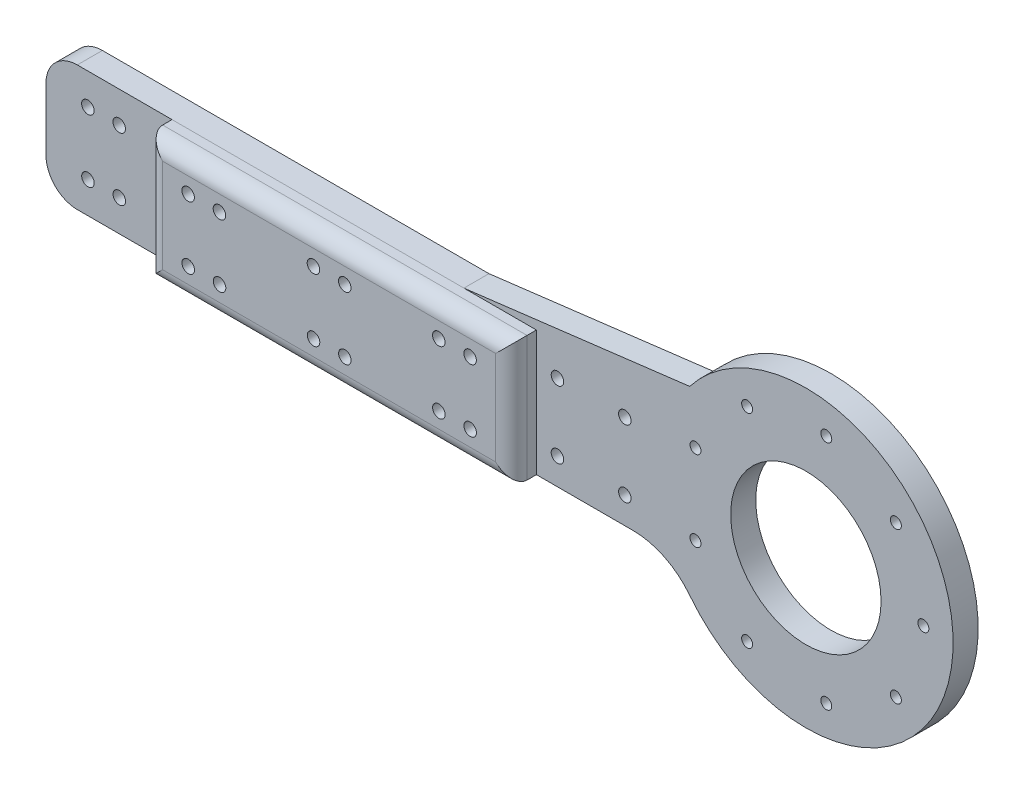
from build123d import *

# Parameters (mm, degrees)
SKETCH_1_R          = 24
SKETCH_1_R_2        = 1.75
EXTRUDE_1_DEPTH     = 8
FILLET_1_R          = 10
FILLET_3_R          = 10
FILLET_8_R          = 23
FILLET_9_R          = 23
SKETCH_3_R          = 2
CUT_EXTRUDE_1_DEPTH = 196.43671136
RIB_1_REACH         = 197.437
SKETCH_6_WALL_W     = 465.474103638
SKETCH_6_WALL_H     = 8
EXTRUDE_START       = 8
SKETCH_11_W         = 116.312569084
SKETCH_11_H         = 40.000018321
SKETCH_11_R         = 2
EXTRUDE_2_DEPTH     = 8
FILLET_11_R         = 5


with BuildPart() as part:
    # 草图1 → 凸台-拉伸1 (new body)
    with BuildSketch(Plane.XY):
        with BuildLine():
            Line((-100, -20), (100, -20))
            ThreePointArc((100, -20), (189.532340636, 0), (100, 20))
            Line((100, 20), (-100, 20))
            Line((-100, 20), (-100, -20))
        make_face()
        with Locations((142.532340636, 0)):
            Circle(SKETCH_1_R, mode=Mode.SUBTRACT)
        with Locations((123.782340636, 32.475952642)):
            Circle(SKETCH_1_R_2, mode=Mode.SUBTRACT)
        with Locations((107.293867357, 12.825755375)):
            Circle(SKETCH_1_R_2, mode=Mode.SUBTRACT)
        with Locations((107.293867357, -12.825755375)):
            Circle(SKETCH_1_R_2, mode=Mode.SUBTRACT)
        with Locations((123.782340636, -32.475952642)):
            Circle(SKETCH_1_R_2, mode=Mode.SUBTRACT)
        with Locations((149.044147299, -36.930290738)):
            Circle(SKETCH_1_R_2, mode=Mode.SUBTRACT)
        with Locations((171.259007253, -24.104535363)):
            Circle(SKETCH_1_R_2, mode=Mode.SUBTRACT)
        with Locations((180.032340636, 0)):
            Circle(SKETCH_1_R_2, mode=Mode.SUBTRACT)
        with Locations((171.259007253, 24.104535363)):
            Circle(SKETCH_1_R_2, mode=Mode.SUBTRACT)
        with Locations((149.044147299, 36.930290738)):
            Circle(SKETCH_1_R_2, mode=Mode.SUBTRACT)
    extrude(amount=EXTRUDE_1_DEPTH)

    # 圆角1
    fillet_1_edges = [part.edges().sort_by_distance(p)[0] for p in [
        (-100, 20, 4),
    ]]
    fillet(fillet_1_edges, radius=FILLET_1_R)

    # 圆角3
    fillet_3_edges = [part.edges().sort_by_distance(p)[0] for p in [
        (-100, -20, 4),
    ]]
    fillet(fillet_3_edges, radius=FILLET_3_R)

    # 圆角8
    fillet_8_edges = [part.edges().sort_by_distance(p)[0] for p in [
        (100, -20, 4),
    ]]
    fillet(fillet_8_edges, radius=FILLET_8_R)

    # 圆角9
    fillet_9_edges = [part.edges().sort_by_distance(p)[0] for p in [
        (100, 20, 4),
    ]]
    fillet(fillet_9_edges, radius=FILLET_9_R)

    # 草图3 → 切除-拉伸1 (cut, through all)
    with BuildSketch(Plane.XY.offset(8)):
        with Locations((-86.637479545, 10)):
            Circle(SKETCH_3_R)
        with Locations((-86.610408267, -9.999981679)):
            Circle(SKETCH_3_R)
        with Locations((-76.637479545, 10)):
            Circle(SKETCH_3_R)
        with Locations((-76.610408267, -9.999981679)):
            Circle(SKETCH_3_R)
        with Locations((-46.637479545, 10)):
            Circle(SKETCH_3_R)
        with Locations((-46.610408267, -9.999981679)):
            Circle(SKETCH_3_R)
        with Locations((-36.637479545, 10)):
            Circle(SKETCH_3_R)
        with Locations((-36.610408267, -9.999981679)):
            Circle(SKETCH_3_R)
        with Locations((-6.637479545, 10)):
            Circle(SKETCH_3_R)
        with Locations((-6.610408267, -9.999981679)):
            Circle(SKETCH_3_R)
        with Locations((3.362520455, 10)):
            Circle(SKETCH_3_R)
        with Locations((3.389591733, -9.999981679)):
            Circle(SKETCH_3_R)
        with Locations((33.362520455, 10)):
            Circle(SKETCH_3_R)
        with Locations((33.389591733, -9.999981679)):
            Circle(SKETCH_3_R)
        with Locations((43.362520455, 10)):
            Circle(SKETCH_3_R)
        with Locations((43.389591733, -9.999981679)):
            Circle(SKETCH_3_R)
        with Locations((63.247313172, 10)):
            Circle(SKETCH_3_R)
        with Locations((84.747313172, 10)):
            Circle(SKETCH_3_R)
        with Locations((84.747313172, -11.5)):
            Circle(SKETCH_3_R)
        with Locations((63.247313172, -11.5)):
            Circle(SKETCH_3_R)
    extrude(amount=-CUT_EXTRUDE_1_DEPTH, mode=Mode.SUBTRACT)

    # 草图6 wall → 筋1 (add, up to next)
    with BuildSketch(Plane(origin=(69.41709698, 24.435714285, 8), x_dir=(0.992506131536, 0.122194839758, 0), z_dir=(-0.122194839758, 0.992506131536, 0)), mode=Mode.PRIVATE) as rib_1_sk1:
        with Locations((0, 4)):
            Rectangle(SKETCH_6_WALL_W, SKETCH_6_WALL_H)
    rib_1_tool1 = extrude(rib_1_sk1.sketch, amount=-RIB_1_REACH, mode=Mode.PRIVATE) - part.part
    add(rib_1_tool1.solids().sort_by_distance((69.41709698, 24.435714285, 8))[0])

    # 草图11 → 凸台-拉伸2 (add)
    with BuildSketch(Plane.XY.offset(8).offset(EXTRUDE_START)):
        with Locations((-1.623943906, 9.161e-06)):
            Rectangle(SKETCH_11_W, SKETCH_11_H)
        with Locations((-46.637479545, 10)):
            Circle(SKETCH_11_R, mode=Mode.SUBTRACT)
        with Locations((-36.637479545, 10)):
            Circle(SKETCH_11_R, mode=Mode.SUBTRACT)
        with Locations((-36.610408267, -9.999981679)):
            Circle(SKETCH_11_R, mode=Mode.SUBTRACT)
        with Locations((-46.610408267, -9.999981679)):
            Circle(SKETCH_11_R, mode=Mode.SUBTRACT)
        with Locations((-6.637479545, 10)):
            Circle(SKETCH_11_R, mode=Mode.SUBTRACT)
        with Locations((-6.610408267, -9.999981679)):
            Circle(SKETCH_11_R, mode=Mode.SUBTRACT)
        with Locations((3.389591733, -9.999981679)):
            Circle(SKETCH_11_R, mode=Mode.SUBTRACT)
        with Locations((3.362520455, 10)):
            Circle(SKETCH_11_R, mode=Mode.SUBTRACT)
        with Locations((33.362520455, 10)):
            Circle(SKETCH_11_R, mode=Mode.SUBTRACT)
        with Locations((43.362520455, 10)):
            Circle(SKETCH_11_R, mode=Mode.SUBTRACT)
        with Locations((43.389591733, -9.999981679)):
            Circle(SKETCH_11_R, mode=Mode.SUBTRACT)
        with Locations((33.389591733, -9.999981679)):
            Circle(SKETCH_11_R, mode=Mode.SUBTRACT)
    extrude(amount=-EXTRUDE_2_DEPTH)

    # 圆角11
    fillet_11_edges = [part.edges().sort_by_distance(p)[0] for p in [
        (56.532340636, 9.161e-06, 16),
        (-1.623943906, 20.000018321, 16),
        (-59.780228448, 9.161e-06, 16),
        (-1.623943906, -20, 16),
    ]]
    fillet(fillet_11_edges, radius=FILLET_11_R)


solid = part.part
